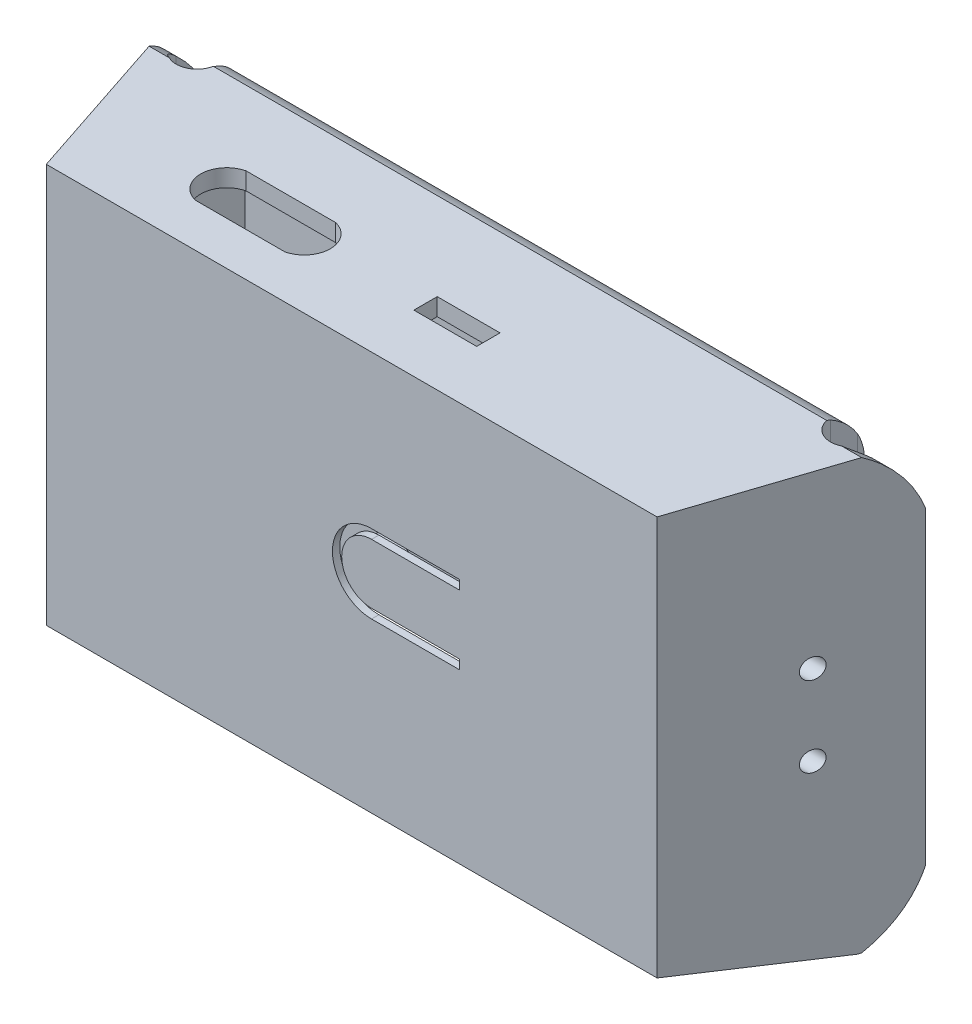
from build123d import *

# Parameters (mm, degrees)
ESQUISSE1_W              = 45.7
ESQUISSE1_H              = 28.7
BOSS_EXTRU_1_DEPTH       = 15.1
ESQUISSE2_W              = 44.1
ESQUISSE2_H              = 13.5
ENL_V_MAT_EXTRU_1_DEPTH  = 27.9
ESQUISSE3_W              = 3.040200108
ESQUISSE3_H              = 27.9
BOSS_EXTRU_2_DEPTH       = 1.3
ENL_V_MAT_EXTRU_2_DEPTH  = 1.3
ESQUISSE5_R              = 1.73665182
BOSS_EXTRU_3_DEPTH       = 1
ESQUISSE6_W              = 4.7
ESQUISSE6_H              = 1.75
ENL_V_MAT_EXTRU_3_DEPTH  = 10.5
ENL_V_MAT_EXTRU_4_DEPTH  = 10.5
BOSS_EXTRU_5_DEPTH       = 28.7
ENL_V_MAT_EXTRU_6_DEPTH  = 28.7
BOSS_EXTRU_7_DEPTH       = 3.4
ESQUISSE25_W             = 45.461360866
ESQUISSE25_H             = 0.9
ENL_V_MAT_EXTRU_14_DEPTH = 14
ENL_V_MAT_EXTRU_15_DEPTH = 57
BOSS_EXTRU_9_DEPTH       = 44.3
ESQUISSE32_R             = 0.75
ENL_V_MAT_EXTRU_17_DEPTH = 44.3
BOSS_EXTRU_10_START      = 0.5
ESQUISSE35_W             = 4.7
ESQUISSE35_H             = 1.75
BOSS_EXTRU_10_DEPTH      = 0.5
ENL_V_START              = -10
ENL_V_MAT_EXTRU_19_DEPTH = 74.3
ENL_V_START_2            = -2.2
ENL_V_MAT_EXTRU_20_DEPTH = 5
ENL_V_MAT_EXTRU_21_DEPTH = 5


with BuildPart() as part:
    # Esquisse1 → Boss.-Extru.1 (new body)
    with BuildSketch(Plane.XY):
        Rectangle(ESQUISSE1_W, ESQUISSE1_H)
    extrude(amount=BOSS_EXTRU_1_DEPTH)

    # Esquisse2 → Enlèv. mat.-Extru.1 (cut)
    with BuildSketch(Plane.XZ.offset(14.35)):
        with Locations((0, 7.8)):
            Rectangle(ESQUISSE2_W, ESQUISSE2_H)
    extrude(amount=-ENL_V_MAT_EXTRU_1_DEPTH, mode=Mode.SUBTRACT)

    # Esquisse3 → Boss.-Extru.2 (add)
    with BuildSketch(Plane.XY.offset(1.05)):
        with Locations((20.529899946, -0.4)):
            Rectangle(ESQUISSE3_W, ESQUISSE3_H)
    extrude(amount=BOSS_EXTRU_2_DEPTH)

    # Esquisse4 → Enlèv. mat.-Extru.2 (cut)
    with BuildSketch(Plane.XY.offset(15.1)):
        with BuildLine():
            Line((1.487226604, 2.215512883), (8.077709912, 2.215512883))
            Line((8.077709912, 2.215512883), (8.077709912, 2.908321808))
            Line((8.077709912, 2.908321808), (1.487226604, 2.908321808))
            ThreePointArc((1.487226604, 2.908321808), (-1.439685537, -0.018590333), (1.487226604, -2.945502474))
            Line((1.487226604, -2.945502474), (8.077709912, -2.945502474))
            Line((8.077709912, -2.945502474), (8.077709912, -2.252693548))
            Line((8.077709912, -2.252693548), (1.487226604, -2.252693548))
            ThreePointArc((1.487226604, -2.252693548), (-0.746876612, -0.018590333), (1.487226604, 2.215512883))
        make_face()
    extrude(amount=-ENL_V_MAT_EXTRU_2_DEPTH, mode=Mode.SUBTRACT)

    # Esquisse5 → Boss.-Extru.3 (add)
    with BuildSketch(Plane(origin=(0, 0, 14.55), x_dir=(-1, 0, 0), z_dir=(0, 0, -1))):
        with Locations((-1.487226604, -0.018590333)):
            Circle(ESQUISSE5_R)
    extrude(amount=BOSS_EXTRU_3_DEPTH)

    # Esquisse6 → Enlèv. mat.-Extru.3 (cut)
    with BuildSketch(Plane.XZ.offset(-13.55)):
        with Locations((2.7, 9.925)):
            Rectangle(ESQUISSE6_W, ESQUISSE6_H)
    extrude(amount=-ENL_V_MAT_EXTRU_3_DEPTH, mode=Mode.SUBTRACT)

    # Esquisse7 → Enlèv. mat.-Extru.4 (cut)
    with BuildSketch(Plane.XZ.offset(-13.55)):
        with BuildLine():
            Line((-14.95, 11.85), (-8.25, 11.85))
            ThreePointArc((-8.25, 11.85), (-6.75, 9.95), (-8.25, 8.05))
            Line((-8.25, 8.05), (-14.95, 8.05))
            ThreePointArc((-14.95, 8.05), (-16.45, 9.95), (-14.95, 11.85))
        make_face()
    extrude(amount=-ENL_V_MAT_EXTRU_4_DEPTH, mode=Mode.SUBTRACT)

    # Esquisse9 → Boss.-Extru.5 (add)
    with BuildSketch(Plane(origin=(0, 14.35, 0), x_dir=(1, 0, 0), z_dir=(0, 1, 0))):
        Polygon((22.85, 0), (22.85, -15.1), (27.85, 0), align=None)
        Polygon((-22.85, 0), (-22.85, -15.1), (-27.85, 0), align=None)
    extrude(amount=-BOSS_EXTRU_5_DEPTH)

    # Esquisse11 → Enlèv. mat.-Extru.6 (cut)
    with BuildSketch(Plane(origin=(0, 14.35, 0), x_dir=(1, 0, 0), z_dir=(0, 1, 0))):
        with BuildLine():
            Line((-25.706241432, 0), (-23.237525969, 0))
            Line((-23.237525969, 0), (-23.237525969, -0.517551291))
            Line((-23.237525969, -0.517551291), (-22.920831586, -2.2))
            ThreePointArc((-22.920831586, -2.2), (-24.475, -3.754168414), (-26.029168414, -2.2))
            Line((-26.029168414, -2.2), (-25.706241432, -0.517551291))
            Line((-25.706241432, -0.517551291), (-25.706241432, 0))
        make_face()
        with BuildLine():
            Line((23.253932079, 0), (25.706636502, 0))
            Line((25.706636502, 0), (25.706636502, -0.464338322))
            Line((25.706636502, -0.464338322), (26.030126108, -2.2))
            ThreePointArc((26.030126108, -2.2), (24.475478847, -3.754647261), (22.920831586, -2.2))
            Line((22.920831586, -2.2), (23.253932079, -0.517551291))
            Line((23.253932079, -0.517551291), (23.253932079, 0))
        make_face()
    extrude(amount=-ENL_V_MAT_EXTRU_6_DEPTH, mode=Mode.SUBTRACT)

    # Esquisse17 → Boss.-Extru.7 (add)
    with BuildSketch(Plane(origin=(0, -14.35, 0), x_dir=(-1, 0, 0), z_dir=(0, -1, 0))):
        with BuildLine():
            Line((27.85, 0), (22.85, -15.1))
            Line((22.85, -15.1), (22.05, -15.1))
            Line((22.05, -15.1), (22.05, -1.05))
            Line((22.05, -1.05), (22.05, 0))
            Line((22.05, 0), (23.237525969, 0))
            Line((23.237525969, 0), (23.237525969, -0.517551291))
            Line((23.237525969, -0.517551291), (22.920831586, -2.2))
            ThreePointArc((22.920831586, -2.2), (24.475, -3.754168414), (26.029168414, -2.2))
            Line((26.029168414, -2.2), (25.706241432, -0.517551291))
            Line((25.706241432, -0.517551291), (25.706241432, 0))
            Line((25.706241432, 0), (27.85, 0))
        make_face()
        with BuildLine():
            Line((-27.85, 0), (-22.85, -15.1))
            Line((-22.85, -15.1), (-22.055908753, -15.1))
            Line((-22.055908753, -15.1), (-22.055908753, 0))
            Line((-22.055908753, 0), (-23.253932079, 0))
            Line((-23.253932079, 0), (-23.253932079, -0.517551291))
            Line((-23.253932079, -0.517551291), (-22.920831586, -2.2))
            ThreePointArc((-22.920831586, -2.2), (-24.475478847, -3.754647261), (-26.030126108, -2.2))
            Line((-26.030126108, -2.2), (-25.706636502, -0.464338322))
            Line((-25.706636502, -0.464338322), (-25.706636502, 0))
            Line((-25.706636502, 0), (-27.85, 0))
        make_face()
    extrude(amount=BOSS_EXTRU_7_DEPTH)

    # Esquisse25 → Enlèv. mat.-Extru.14 (cut)
    with BuildSketch(Plane(origin=(0, 0, 0), x_dir=(-1, 0, 0), z_dir=(0, 0, -1))):
        with Locations((-0.047301347, -14.809065101)):
            Rectangle(ESQUISSE25_W, ESQUISSE25_H)
    extrude(amount=-ENL_V_MAT_EXTRU_14_DEPTH, mode=Mode.SUBTRACT)

    # Esquisse26 → Enlèv. mat.-Extru.15 (cut, symmetric)
    with BuildSketch(Plane(origin=(-22.05, 0, 0), x_dir=(0, 0, -1), z_dir=(1, 0, 0))):
        Polygon((-3.85, -17.75), (-15.1, -15.527418892), (-15.1, -17.75), align=None)
    extrude(amount=ENL_V_MAT_EXTRU_15_DEPTH, both=True, mode=Mode.SUBTRACT)

    # Esquisse31 → Boss.-Extru.9 (add)
    with BuildSketch(Plane.ZY.offset(-22.055908753)):
        Polygon((14.002730008, -14.35), (14.002730008, -15.744198586), (15.1, -15.527418892), (15.1, -14.35), align=None)
    extrude(amount=BOSS_EXTRU_9_DEPTH)

    # Esquisse32 → Enlèv. mat.-Extru.17 (cut)
    with BuildSketch(Plane.ZY.offset(-22.05)):
        with Locations((6.35, 1.6)):
            Circle(ESQUISSE32_R)
        with Locations((6.35, -4.4)):
            Circle(ESQUISSE32_R)
    extrude(amount=-ENL_V_MAT_EXTRU_17_DEPTH, mode=Mode.SUBTRACT)

    # Esquisse35 → Boss.-Extru.10 (add)
    with BuildSketch(Plane.XZ.offset(-13.55).offset(BOSS_EXTRU_10_START)):
        Polygon((-22.05, 14.002730008), (-22.05, 1.05), (19.009799892, 1.05), (19.009799892, 2.35), (22.05, 2.35), (22.055908753, 14.002730008), align=None)
        with Locations((2.7, 9.925)):
            Rectangle(ESQUISSE35_W, ESQUISSE35_H, mode=Mode.SUBTRACT)
        with BuildLine():
            Line((-14.95, 11.85), (-8.25, 11.85))
            ThreePointArc((-8.25, 11.85), (-6.75, 9.95), (-8.25, 8.05))
            Line((-8.25, 8.05), (-14.95, 8.05))
            ThreePointArc((-14.95, 8.05), (-16.45, 9.95), (-14.95, 11.85))
        make_face(mode=Mode.SUBTRACT)
    extrude(amount=-BOSS_EXTRU_10_DEPTH)

    # Esquisse34 → Enlèv. mat.-Extru.19 (cut)
    with BuildSketch(Plane(origin=(-22.05, 0, 0), x_dir=(0, 0, -1), z_dir=(1, 0, 0)).offset(ENL_V_START)):
        with BuildLine():
            Line((0, 11.05), (2.149848575, 13.466695377))
            Line((2.149848575, 13.466695377), (2.704974512, 17.199769042))
            Line((2.704974512, 17.199769042), (-2.5, 14.35))
            ThreePointArc((-2.5, 14.35), (-0.778882836, 13.056906943), (0, 11.05))
        make_face()
        with BuildLine():
            Line((0, -14.45), (2.615471919, -12.438405433))
            Line((2.615471919, -12.438405433), (4.64721223, -16.898892781))
            Line((4.64721223, -16.898892781), (-1.312082168, -20.336026793))
            Line((-1.312082168, -20.336026793), (-2.5, -17.75))
            ThreePointArc((-2.5, -17.75), (-0.778882836, -16.456906943), (0, -14.45))
        make_face()
    extrude(amount=ENL_V_MAT_EXTRU_19_DEPTH, mode=Mode.SUBTRACT)

    # Esquisse36 → Enlèv. mat.-Extru.20 (cut)
    with BuildSketch(Plane(origin=(-22.05, 0, 0), x_dir=(0, 0, -1), z_dir=(1, 0, 0)).offset(ENL_V_START_2)):
        with BuildLine():
            Line((-3.6, 14.35), (0.233137936, 16.139667024))
            Line((0.233137936, 16.139667024), (1.281634534, 9.28497369))
            Line((1.281634534, 9.28497369), (0, 9.85))
            ThreePointArc((0, 9.85), (-1.384829505, 12.432136396), (-3.6, 14.35))
        make_face()
        with BuildLine():
            Line((0, -13.25), (2.408593259, -12.125443566))
            Line((2.408593259, -12.125443566), (1.20429663, -19.634076372))
            Line((1.20429663, -19.634076372), (-3.6, -17.75))
            ThreePointArc((-3.6, -17.75), (-1.366017246, -15.847186204), (0, -13.25))
        make_face()
    extrude(amount=-ENL_V_MAT_EXTRU_20_DEPTH, mode=Mode.SUBTRACT)

    # Esquisse37 → Enlèv. mat.-Extru.21 (cut)
    with BuildSketch(Plane.ZY.offset(-22.05).offset(ENL_V_START_2)):
        with BuildLine():
            Line((3.6, -19.426253986), (3.6, -17.75))
            ThreePointArc((3.6, -17.75), (1.385821361, -15.831342911), (0, -13.25))
            Line((0, -13.25), (-1.954897573, -12.307105099))
            Line((-1.954897573, -12.307105099), (-2.275009075, -21.310589074))
            Line((-2.275009075, -21.310589074), (3.6, -19.426253986))
        make_face()
        with BuildLine():
            Line((3.6, 14.35), (1.25201602, 16.69798398))
            Line((1.25201602, 16.69798398), (-2.772630017, 8.353712777))
            Line((-2.772630017, 8.353712777), (0, 9.85))
            ThreePointArc((0, 9.85), (1.388075747, 12.429539402), (3.6, 14.35))
        make_face()
    extrude(amount=-ENL_V_MAT_EXTRU_21_DEPTH, mode=Mode.SUBTRACT)


solid = part.part
